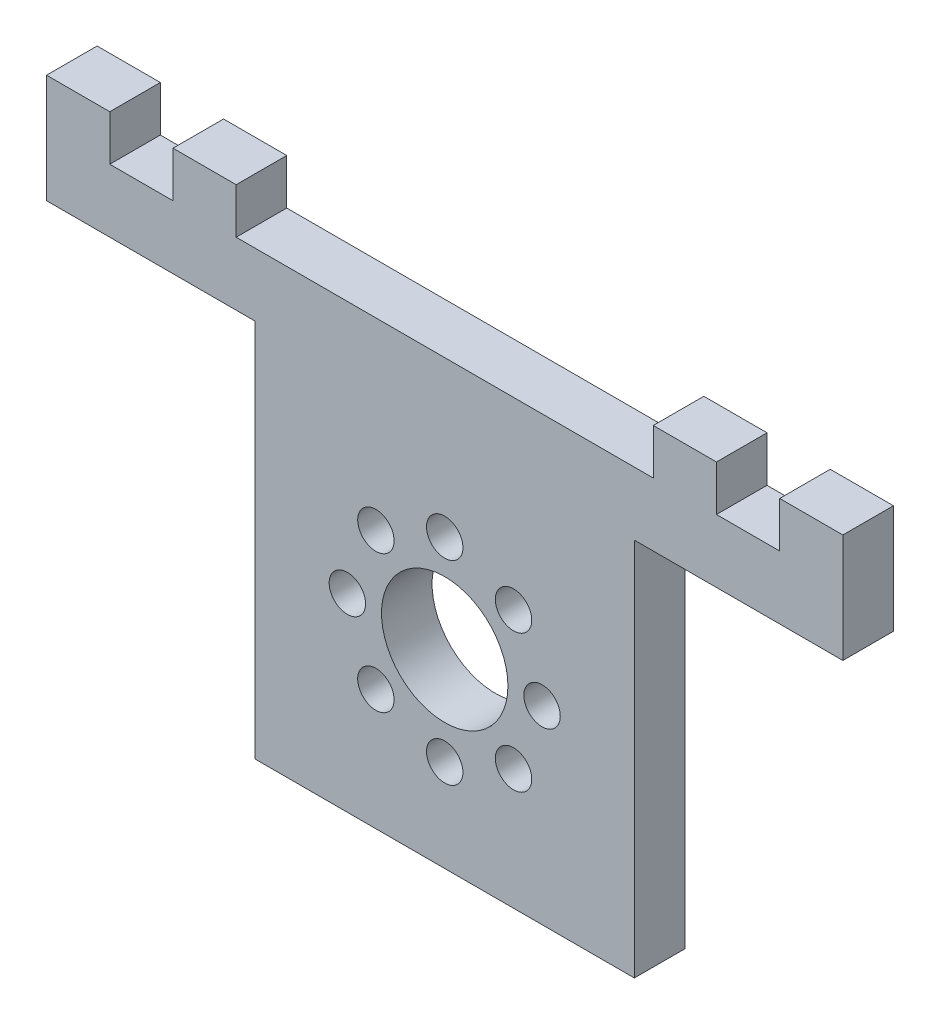
from build123d import *

# Parameters (mm, degrees)
BOSS_EXTRUDE1_DEPTH = 5.08
SKETCH3_W           = 6.35
SKETCH3_H           = 4.572
BOSS_EXTRUDE2_DEPTH = 5.08
SKETCH4_R           = 6.35
SKETCH4_R_2         = 1.8288
CUT_EXTRUDE1_DEPTH  = 5.08
SKETCH5_W           = 29.19984
SKETCH5_H           = 4.572
CUT_EXTRUDE2_DEPTH  = 5.08


with BuildPart() as part:
    # Sketch1 → Boss-Extrude1 (new body)
    with BuildSketch(Plane.XY):
        Polygon((-22.91953125, 7.590234375), (-22.91953125, 1.240234375), (-1.96961125, 1.240234375), (-1.96961125, -36.859765625), (36.13038875, -36.859765625), (36.13038875, 1.240234375), (57.08030875, 1.240234375), (57.08030875, 7.590234375), align=None)
    extrude(amount=BOSS_EXTRUDE1_DEPTH)

    # Sketch3 → Boss-Extrude2 (add)
    with BuildSketch(Plane(origin=(0, 0, 0), x_dir=(-1, 0, 0), z_dir=(0, 0, -1))):
        with Locations((19.74453125, 9.876234375)):
            Rectangle(SKETCH3_W, SKETCH3_H)
        with Locations((7.04453125, 9.876234375)):
            Rectangle(SKETCH3_W, SKETCH3_H)
        with Locations((-5.65546875, 9.876234375)):
            Rectangle(SKETCH3_W, SKETCH3_H)
        with Locations((-28.50530875, 9.876234375)):
            Rectangle(SKETCH3_W, SKETCH3_H)
        with Locations((-41.20530875, 9.876234375)):
            Rectangle(SKETCH3_W, SKETCH3_H)
        with Locations((-53.90530875, 9.876234375)):
            Rectangle(SKETCH3_W, SKETCH3_H)
    extrude(amount=-BOSS_EXTRUDE2_DEPTH)

    # Sketch4 → Cut-Extrude1 (cut)
    with BuildSketch(Plane.XY.offset(5.08)):
        with Locations((17.08038875, -17.809765625)):
            Circle(SKETCH4_R)
        with Locations((7.30138875, -17.809765625)):
            Circle(SKETCH4_R_2)
        with Locations((10.165591537, -10.894968412)):
            Circle(SKETCH4_R_2)
        with Locations((17.08038875, -8.030765625)):
            Circle(SKETCH4_R_2)
        with Locations((23.995185963, -10.894968412)):
            Circle(SKETCH4_R_2)
        with Locations((26.85938875, -17.809765625)):
            Circle(SKETCH4_R_2)
        with Locations((23.995185963, -24.724562838)):
            Circle(SKETCH4_R_2)
        with Locations((17.08038875, -27.588765625)):
            Circle(SKETCH4_R_2)
        with Locations((10.165591537, -24.724562838)):
            Circle(SKETCH4_R_2)
    extrude(amount=-CUT_EXTRUDE1_DEPTH, mode=Mode.SUBTRACT)

    # Sketch5 → Cut-Extrude2 (cut)
    with BuildSketch(Plane.XY.offset(5.08)):
        with Locations((17.08038875, 9.876234375)):
            Rectangle(SKETCH5_W, SKETCH5_H)
    extrude(amount=-CUT_EXTRUDE2_DEPTH, mode=Mode.SUBTRACT)


solid = part.part
